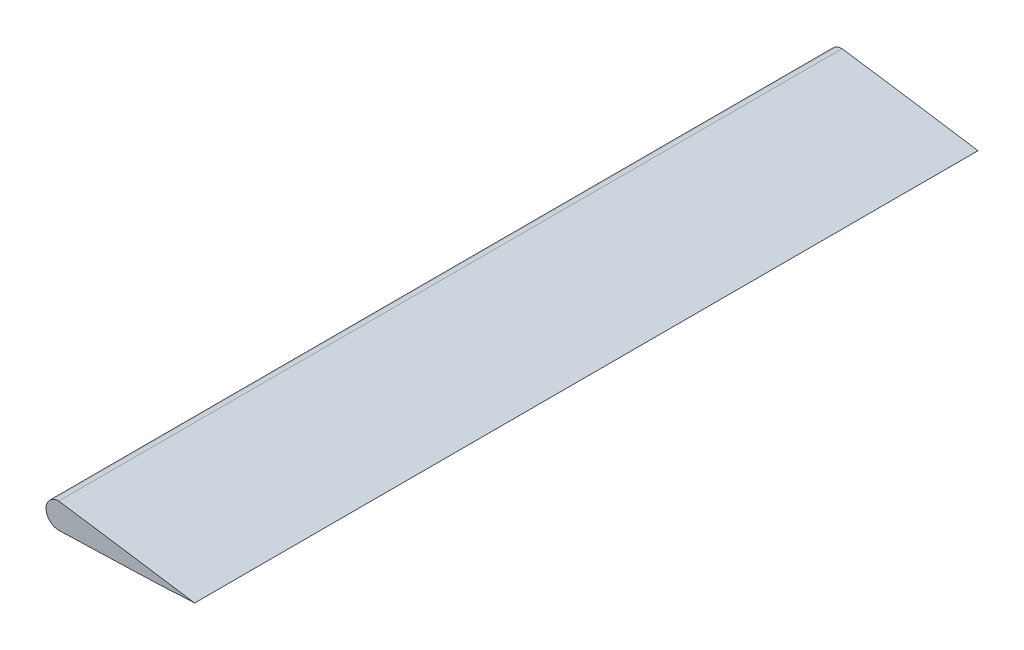
from build123d import *

# Parameters (mm, degrees)
BOSS_EXTRUDE1_DEPTH = 196


with BuildPart() as part:
    # Sketch1 → Boss-Extrude1 (new body)
    with BuildSketch(Plane.XY):
        with BuildLine():
            ThreePointArc((80, 5.10643727), (76.82835135, 1.93478862), (80, -1.236860029))
            add(Edge.make_bspline(
                [(80, -1.236860029), (80.754133513, -1.213256452), (83.313627998, -1.133331871), (87.557232018, -1.001997255), (92.588760477, -0.848416164), (97.194643839, -0.705344581), (101.321436256, -0.575266297), (104.908193417, -0.447130761), (107.966500673, -0.305286903), (110.34588768, -0.151439695), (112.326393476, -0.052333967), (113.163828047, 0.005806118), (114.212511419, -0.011144837), (113.170904548, 0.081098126), (112.343110594, 0.220293735), (110.384127786, 0.521461873), (108.034544222, 0.920009195), (105.018396274, 1.396187001), (101.494499518, 1.927113236), (97.463027277, 2.529160239), (92.994096619, 3.195496811), (88.145824691, 3.913537354), (83.772841579, 4.558428255), (81.022533328, 4.958536929), (80, 5.10643727)],
                knots=[0.853083665, 0.853083665, 0.853083665, 0.853083665, 0.862857512, 0.886255642, 0.908082562, 0.928062893, 0.945960634, 0.961531405, 0.974665069, 0.985301353, 0.993278046, 0.998281974, 1, 1.001709089, 1.006705544, 1.014679448, 1.025320415, 1.038434023, 1.053918399, 1.071592653, 1.091201485, 1.112460131, 1.135078967, 1.148462708, 1.148462708, 1.148462708, 1.148462708], degree=3))
        make_face()
    extrude(amount=BOSS_EXTRUDE1_DEPTH)


solid = part.part
